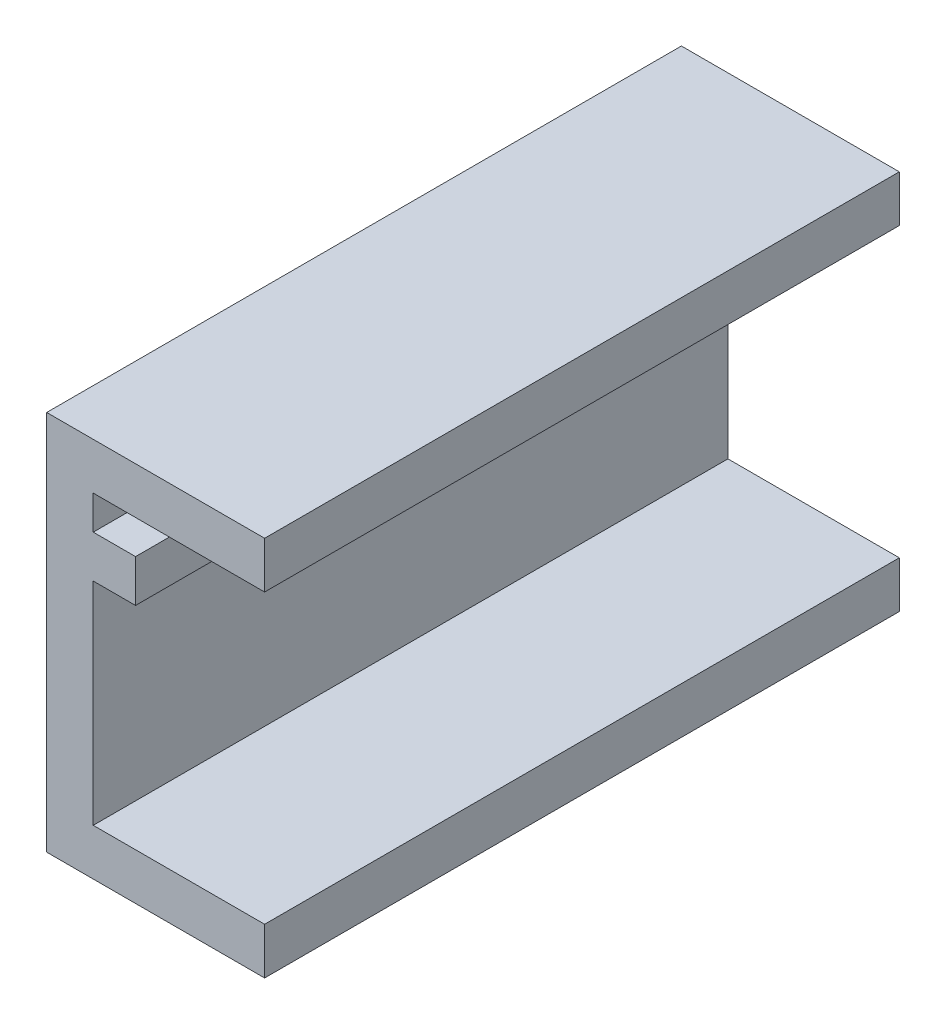
from build123d import *

# Parameters (mm, degrees)
BOSS_EXTRUDE1_DEPTH = 30


with BuildPart() as part:
    # Sketch1 → Boss-Extrude1 (new body)
    with BuildSketch(Plane.XY):
        Polygon((-8.1, 14.2), (-6.1, 14.2), (-6.1, 12.2), (-8.1, 12.2), (-8.1, 2.2), (0, 2.2), (0, 0), (-10.3, 0), (-10.3, 18), (0, 18), (0, 15.8), (-8.1, 15.8), align=None)
    extrude(amount=BOSS_EXTRUDE1_DEPTH)


solid = part.part
